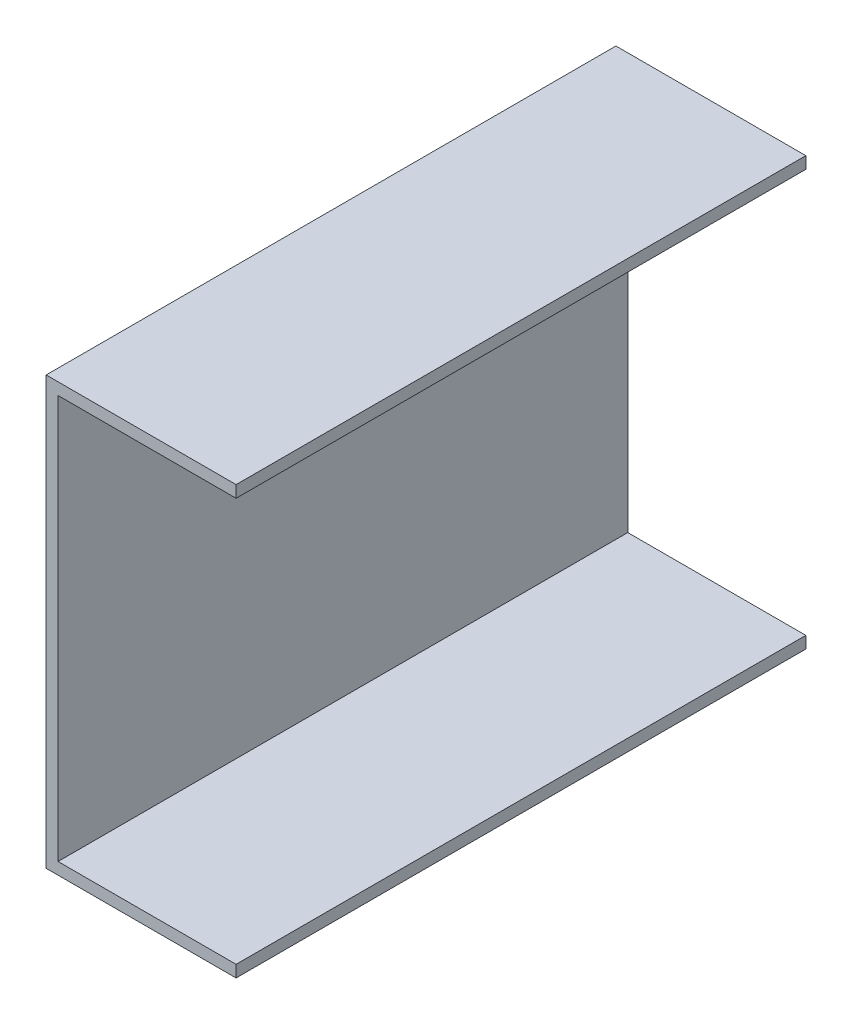
from build123d import *

# Parameters (mm, degrees)
EXTRUDE_THIN1_DEPTH = 76.2


with BuildPart() as part:
    # Sketch1 → Extrude-Thin1 (new body)
    with BuildSketch(Plane.XY):
        Polygon((0, 0), (-25.4, 0), (-25.4, -57.15), (0, -57.15), (0, -55.5625), (-23.8125, -55.5625), (-23.8125, -1.5875), (0, -1.5875), align=None)
    extrude(amount=EXTRUDE_THIN1_DEPTH)


solid = part.part
